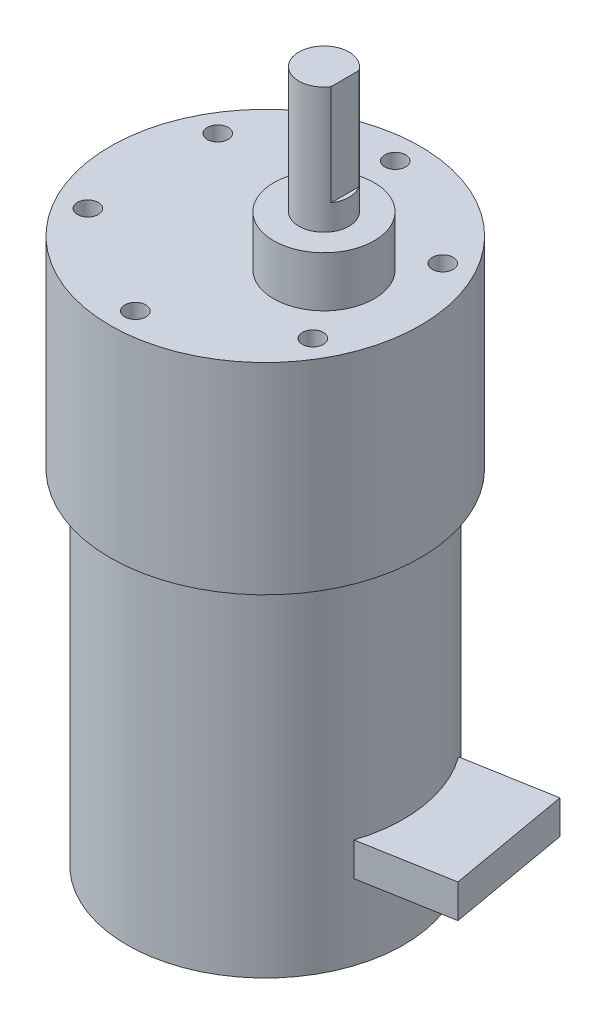
from build123d import *

# Parameters (mm, degrees)
SKETCH1_R           = 18.5
BOSS_EXTRUDE1_DEPTH = 24
SKETCH2_R           = 16.5
BOSS_EXTRUDE2_DEPTH = 41
SKETCH6_R           = 1.25
CUT_EXTRUDE1_DEPTH  = 3.5
SKETCH7_R           = 6
BOSS_EXTRUDE5_DEPTH = 6
SKETCH8_R           = 3
BOSS_EXTRUDE6_DEPTH = 15
CUT_EXTRUDE2_START  = -12
CUT_EXTRUDE2_DEPTH  = 12
SKETCH3_W           = 4
SKETCH3_H           = 15
BOSS_EXTRUDE4_DEPTH = 8.763


with BuildPart() as part:
    # Sketch1 → Boss-Extrude1 (new body)
    with BuildSketch(Plane(origin=(0, 0, 0), x_dir=(1, 0, 0), z_dir=(0, 1, 0))):
        with Locations(Location((0, 0, 0), (0, 0, 270))):
            Circle(SKETCH1_R)
    extrude(amount=BOSS_EXTRUDE1_DEPTH)

    # Sketch2 → Boss-Extrude2 (add)
    with BuildSketch(Plane.XZ):
        with Locations(Location((0, 0, 0), (0, 0, 270))):
            Circle(SKETCH2_R)
    extrude(amount=BOSS_EXTRUDE2_DEPTH)

    # Sketch6 → Cut-Extrude1 (cut)
    with BuildSketch(Plane(origin=(0, 24, 0), x_dir=(1, 0, 0), z_dir=(0, 1, 0))):
        with Locations(Location((13.423393759, 7.75, 0), (0, 0, 270))):
            Circle(SKETCH6_R)
        with Locations(Location((0, 15.5, 0), (0, 0, 270))):
            Circle(SKETCH6_R)
        with Locations(Location((13.423393759, -7.75, 0), (0, 0, 270))):
            Circle(SKETCH6_R)
        with Locations(Location((0, -15.5, 0), (0, 0, 270))):
            Circle(SKETCH6_R)
        with Locations(Location((-13.423393759, -7.75, 0), (0, 0, 270))):
            Circle(SKETCH6_R)
        with Locations(Location((-13.423393759, 7.75, 0), (0, 0, 270))):
            Circle(SKETCH6_R)
    extrude(amount=-CUT_EXTRUDE1_DEPTH, mode=Mode.SUBTRACT)

    # Sketch7 → Boss-Extrude5 (add)
    with BuildSketch(Plane(origin=(0, 24, 0), x_dir=(1, 0, 0), z_dir=(0, 1, 0))):
        with Locations(Location((7, 0, 0), (0, 0, 270))):
            Circle(SKETCH7_R)
    extrude(amount=BOSS_EXTRUDE5_DEPTH)

    # Sketch8 → Boss-Extrude6 (add)
    with BuildSketch(Plane(origin=(0, 30, 0), x_dir=(1, 0, 0), z_dir=(0, 1, 0))):
        with Locations(Location((7, 0, 0), (0, 0, 270))):
            Circle(SKETCH8_R)
    extrude(amount=BOSS_EXTRUDE6_DEPTH)

    # Sketch9 → Cut-Extrude2 (cut)
    with BuildSketch(Plane(origin=(0, 45, 0), x_dir=(1, 0, 0), z_dir=(0, 1, 0)).offset(CUT_EXTRUDE2_START)):
        with BuildLine():
            Line((9.5, 1.658312395), (9.5, -1.658312395))
            ThreePointArc((9.5, -1.658312395), (10, 0), (9.5, 1.658312395))
        make_face()
    extrude(amount=CUT_EXTRUDE2_DEPTH, mode=Mode.SUBTRACT)

    # Sketch3 → Boss-Extrude4 (add, symmetric)
    with BuildSketch(Plane(origin=(16.249327925, 0, -2.865194932), x_dir=(0, 1, 0), z_dir=(0.984807753012208, 0, -0.17364817766693072))):
        with Locations((-30, 0.254363191)):
            Rectangle(SKETCH3_W, SKETCH3_H)
    extrude(amount=BOSS_EXTRUDE4_DEPTH, both=True)


solid = part.part
